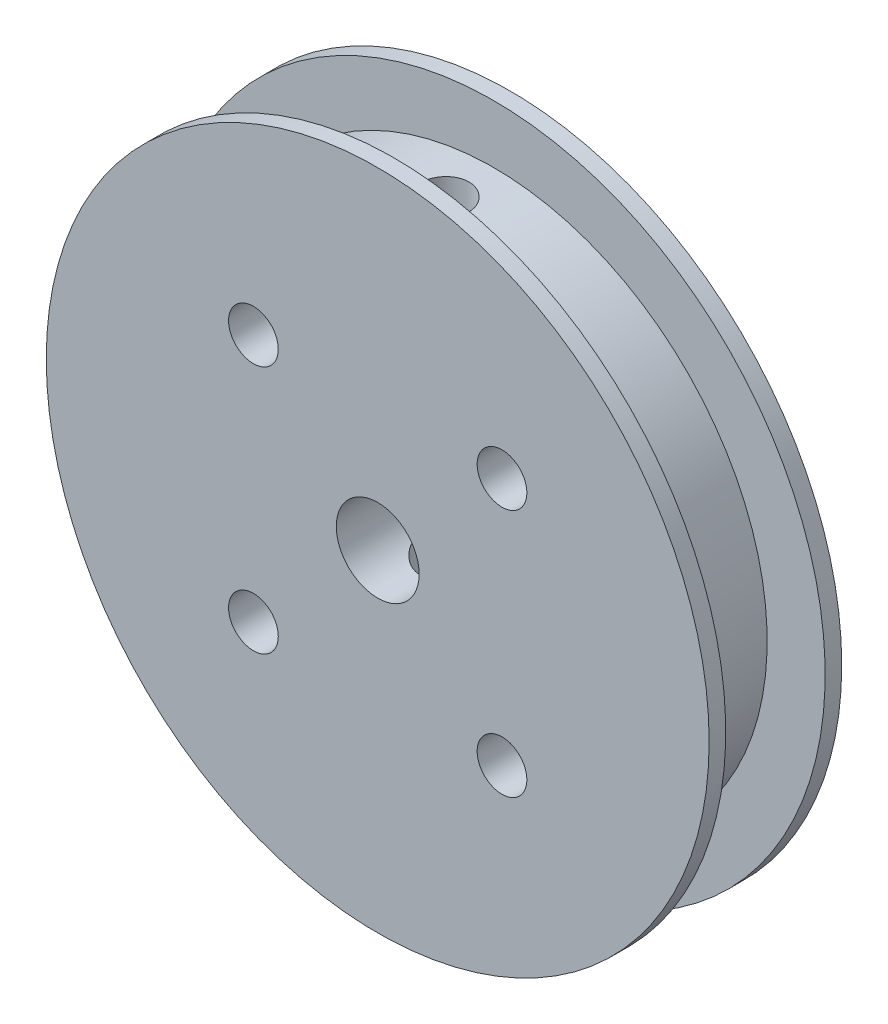
from build123d import *

# Parameters (mm, degrees)
SKETCH1_R                                       = 20
PULLEY_BOSS_EXTRUDE1_DEPTH                      = 8
SKETCH2_W                                       = 3.5
SKETCH2_H                                       = 6
SKETCH3_R                                       = 2.5
SHAFT_CUT_EXTRUDE1_DEPTH                        = 8
SPRINT_HOLE_CUT_EXTRUDE2_REACH                  = 31.394
SPRINT_HOLE_CUT_EXTRUDE2_END_RADIUS             = 16.5
SKETCH4_R                                       = 1.5
SPRINT_HOLE_CUT_EXTRUDE2_DIRECTION_2_REACH      = 31.394
SPRINT_HOLE_CUT_EXTRUDE2_DIRECTION_2_END_RADIUS = 16.5
SKETCH5_R                                       = 1.5
ARM_DISTANS_MOUNTING_HOLES_CUT_EXTRUDE1_DEPTH   = 8


with BuildPart() as part:
    # Sketch1 → Pulley Boss-Extrude1 (new body)
    with BuildSketch(Plane.XY):
        Circle(SKETCH1_R)
    extrude(amount=PULLEY_BOSS_EXTRUDE1_DEPTH)

    # Sketch2 → Belt Cut-Revolve3 (revolve, cut)
    with BuildSketch(Plane(origin=(0, 0, 0), x_dir=(1, 0, 0), z_dir=(0, 1, 0)), mode=Mode.PRIVATE) as belt_cut_revolve3_sk:
        with Locations((18.25, -4)):
            Rectangle(SKETCH2_W, SKETCH2_H)
    revolve(belt_cut_revolve3_sk.sketch.rotate(Axis((0, 0, -14.62158436), (0, 0, 1)), 180), axis=Axis((0, 0, -14.62158436), (0, 0, 1)), mode=Mode.SUBTRACT)

    # Sketch3 → Shaft Cut-Extrude1 (cut)
    with BuildSketch(Plane.XY):
        Circle(SKETCH3_R)
    extrude(amount=SHAFT_CUT_EXTRUDE1_DEPTH, mode=Mode.SUBTRACT)

    # Sprint Hole Cut-Extrude2: up to this cylinder (the profile starts inside it)
    sprint_hole_cut_extrude2_end = Plane(origin=(0, 0, 4), z_dir=(0, 0, -1)) * Cylinder(SPRINT_HOLE_CUT_EXTRUDE2_END_RADIUS, 96.788, mode=Mode.PRIVATE)
    # Sketch4 → Sprint Hole Cut-Extrude2 (cut, up to the surface)
    with BuildSketch(Plane(origin=(0, 0, 0), x_dir=(1, 0, 0), z_dir=(0, 1, 0)), mode=Mode.PRIVATE) as sprint_hole_cut_extrude2_sk1:
        with Locations(Location((0, -4, 0), (0, 0, 270))):
            Circle(SKETCH4_R)
    sprint_hole_cut_extrude2_tool1 = extrude(sprint_hole_cut_extrude2_sk1.sketch, amount=-SPRINT_HOLE_CUT_EXTRUDE2_REACH, mode=Mode.PRIVATE) & sprint_hole_cut_extrude2_end
    add(sprint_hole_cut_extrude2_tool1.solids().sort_by_distance((0, 0, 4))[0], mode=Mode.SUBTRACT)

    # Sprint Hole Cut-Extrude2 direction 2: up to this cylinder (the profile starts inside it)
    sprint_hole_cut_extrude2_direction_2_end = Plane(origin=(0, 0, 4), z_dir=(0, 0, -1)) * Cylinder(SPRINT_HOLE_CUT_EXTRUDE2_DIRECTION_2_END_RADIUS, 96.788, mode=Mode.PRIVATE)
    # Sketch4 → Sprint Hole Cut-Extrude2 direction 2 (cut, up to the surface)
    with BuildSketch(Plane(origin=(0, 0, 0), x_dir=(1, 0, 0), z_dir=(0, 1, 0)), mode=Mode.PRIVATE) as sprint_hole_cut_extrude2_direction_2_sk1:
        with Locations(Location((0, -4, 0), (0, 0, 270))):
            Circle(SKETCH4_R)
    sprint_hole_cut_extrude2_direction_2_tool1 = extrude(sprint_hole_cut_extrude2_direction_2_sk1.sketch, amount=SPRINT_HOLE_CUT_EXTRUDE2_DIRECTION_2_REACH, mode=Mode.PRIVATE) & sprint_hole_cut_extrude2_direction_2_end
    add(sprint_hole_cut_extrude2_direction_2_tool1.solids().sort_by_distance((0, 0, 4))[0], mode=Mode.SUBTRACT)

    # Sketch5 → Arm Distans Mounting Holes Cut-Extrude1 (cut)
    with BuildSketch(Plane.XY.offset(8)):
        with Locations((7.5, 7.5)):
            Circle(SKETCH5_R)
        with Locations((-7.5, 7.5)):
            Circle(SKETCH5_R)
        with Locations((-7.5, -7.5)):
            Circle(SKETCH5_R)
        with Locations((7.5, -7.5)):
            Circle(SKETCH5_R)
    extrude(amount=-ARM_DISTANS_MOUNTING_HOLES_CUT_EXTRUDE1_DEPTH, mode=Mode.SUBTRACT)


solid = part.part
